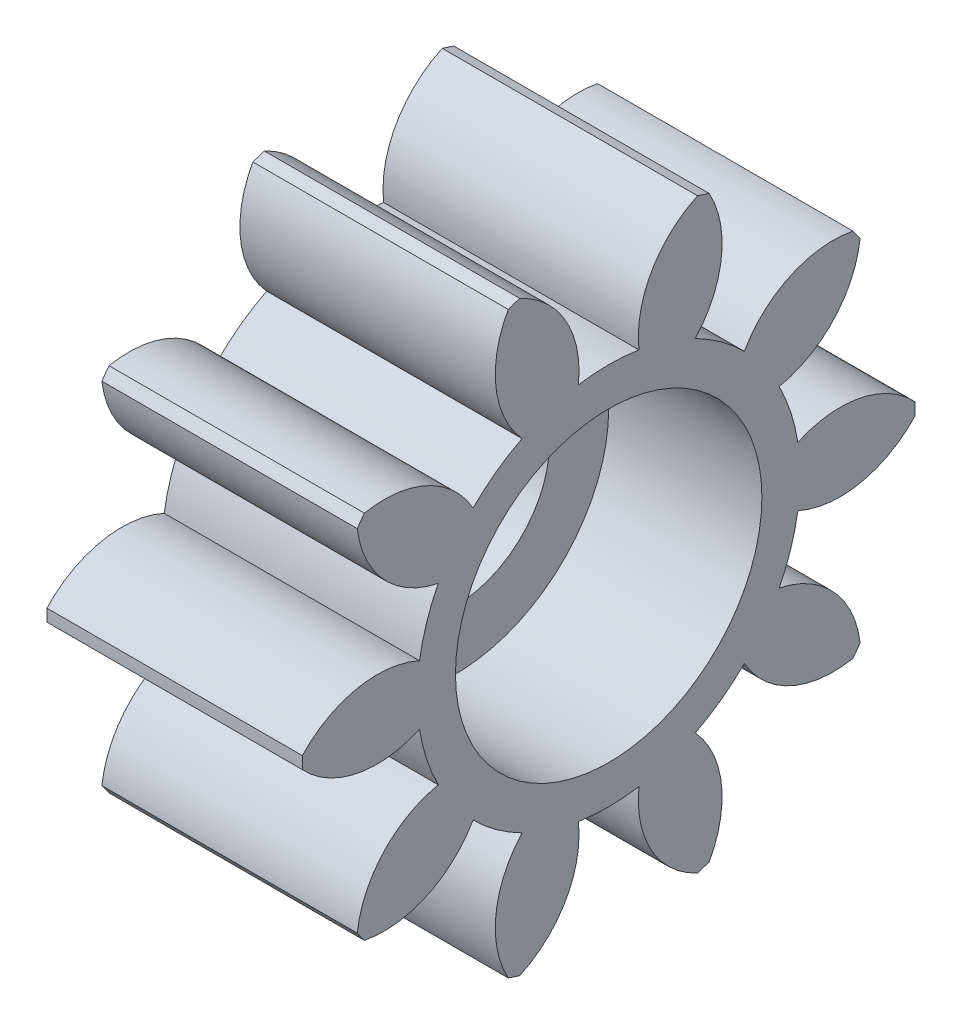
from build123d import *

# Parameters (mm, degrees)
BASPROSKE_W        = 5
BASPROSKE_H        = 6
TOOTHCUT_DEPTH     = 10.848857802
TEETHCUTS_COUNT    = 10
TEETHCUTS_ANGLE    = 324
BORSKE_R           = 1.5
BORE_DEPTH         = 50.0000508
SKETCH1_R          = 3
CUT_EXTRUDE1_DEPTH = 3
SCALE1_SCALE       = 0.95
SKETCH2_R          = 1.75
CUT_EXTRUDE2_DEPTH = 9.38856389


with BuildPart() as part:
    # BasProSke → Base-Revolve (revolve)
    with BuildSketch(Plane(origin=(0, 0, 0), x_dir=(1, 0, 0), z_dir=(0, 1, 0)), mode=Mode.PRIVATE) as base_revolve_sk:
        with Locations((2.5, 3)):
            Rectangle(BASPROSKE_W, BASPROSKE_H)
    revolve(base_revolve_sk.sketch.rotate(Axis((-10, 0, 0), (1, 0, 0)), 180), axis=Axis((-10, 0, 0), (1, 0, 0)))

    # TooCutSke → ToothCut (cut, through all)
    with BuildSketch(Plane(origin=(0, 0, 0), x_dir=(0, 0, -1), z_dir=(1, 0, 0))):
        with BuildLine():
            ThreePointArc((0.59278292, 3.701838653), (0, 3.749), (-0.59278292, 3.701838653))
            ThreePointArc((-0.59278292, 3.701838653), (-0.846593509, 4.924114224), (-1.775771316, 5.757784417))
            ThreePointArc((-1.775771316, 5.757784417), (0, 6.0254), (1.775771316, 5.757784417))
            ThreePointArc((1.775771316, 5.757784417), (0.846593509, 4.924114224), (0.59278292, 3.701838653))
        make_face()
    toothcut = extrude(amount=TOOTHCUT_DEPTH, mode=Mode.SUBTRACT)

    # TeethCuts: ToothCut ×10 about axis
    teethcuts_axis = Axis((-10, 0, 0), (1, 0, 0))
    for i in range(1, TEETHCUTS_COUNT):
        add(toothcut.rotate(teethcuts_axis, i * TEETHCUTS_ANGLE / (TEETHCUTS_COUNT - 1)), mode=Mode.SUBTRACT)

    # BorSke → Bore (cut, symmetric)
    with BuildSketch(Plane(origin=(0, 0, 0), x_dir=(0, 0, -1), z_dir=(1, 0, 0))):
        with Locations(Location((0, 0, 0), (0, 0, 180))):
            Circle(BORSKE_R)
    extrude(amount=BORE_DEPTH, both=True, mode=Mode.SUBTRACT)

    # Sketch1 → Cut-Extrude1 (cut)
    with BuildSketch(Plane(origin=(5, 0, 0), x_dir=(0, 0, -1), z_dir=(1, 0, 0))):
        Circle(SKETCH1_R)
    extrude(amount=-CUT_EXTRUDE1_DEPTH, mode=Mode.SUBTRACT)


with BuildPart() as part_1:
    # Scale1: scaled about (2.255821785, 0, 0)
    add(part.part.scale(SCALE1_SCALE).moved(Location((0.112791089, 0, 0))))

    # Sketch2 → Cut-Extrude2 (cut, through all)
    with BuildSketch(Plane(origin=(2.012791089, 0, 0), x_dir=(0, 0, -1), z_dir=(1, 0, 0))):
        Circle(SKETCH2_R)
    extrude(amount=-CUT_EXTRUDE2_DEPTH, mode=Mode.SUBTRACT)


solid = part_1.part
